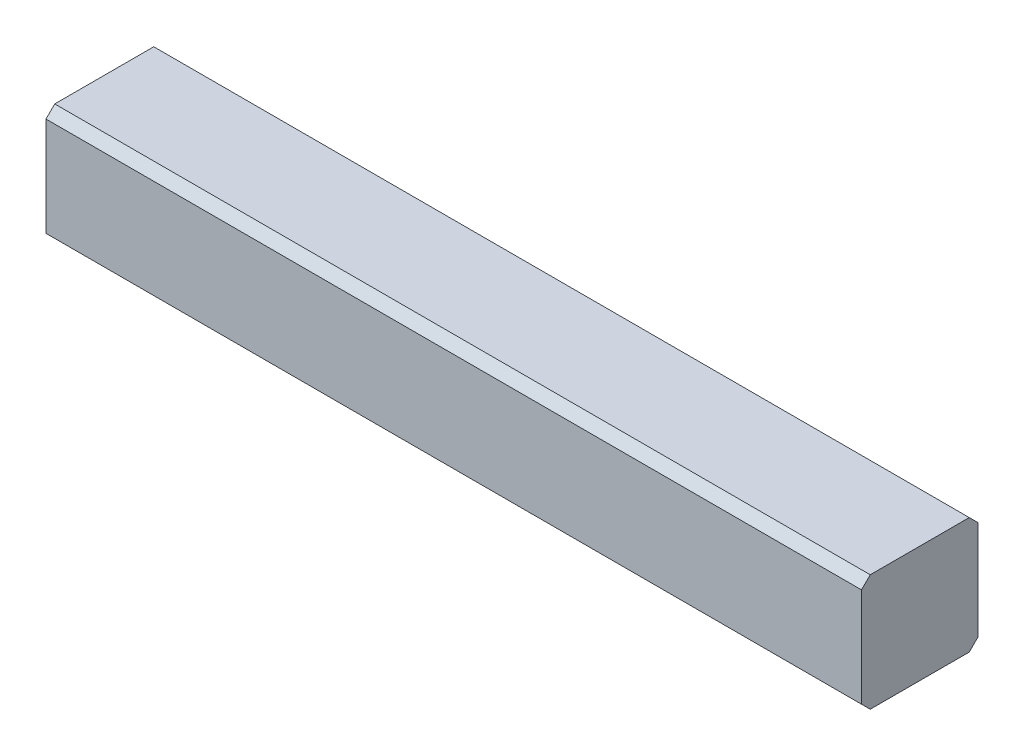
from build123d import *

# Parameters (mm, degrees)
BOSS_EXTRUDE1_DEPTH = 14


with BuildPart() as part:
    # Sketch1 → Boss-Extrude1 (new body)
    with BuildSketch(Plane(origin=(0, 0, 0), x_dir=(0, 0, -1), z_dir=(1, 0, 0))):
        Polygon((-0.85, 1), (-1, 0.85), (-1, -0.85), (-0.85, -1), (0.85, -1), (1, -0.85), (1, 0.85), (0.85, 1), align=None)
    extrude(amount=BOSS_EXTRUDE1_DEPTH)


solid = part.part
